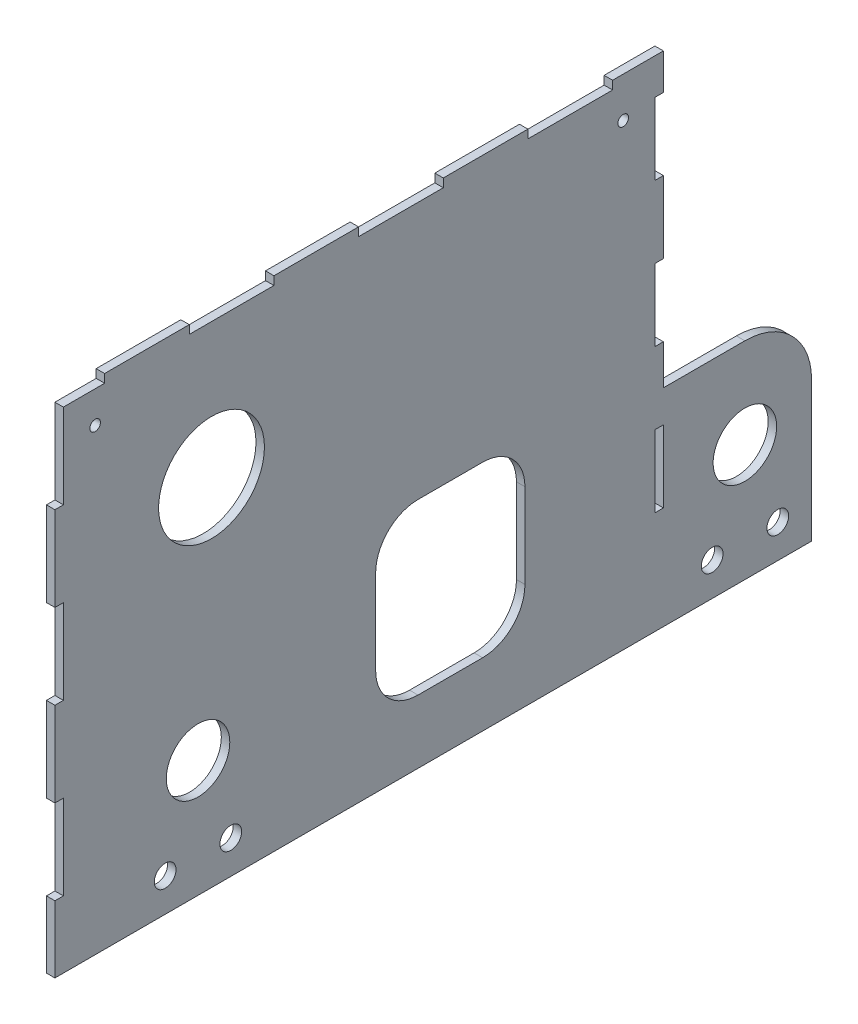
from build123d import *

# Parameters (mm, degrees)
SKETCH1_W                   = 224.46234
SKETCH1_H                   = 149.606
BOSS_EXTRUDE1_DEPTH         = 2.54
SKETCH2_W                   = 44.45
SKETCH2_H                   = 87.5411
CUT_EXTRUDE1_DEPTH          = 135.899132423
FILLET1_R                   = 20.0025
F_1_4_CLEARANCE_HOLE1_D     = 6.5278
F_1_4_CLEARANCE_HOLE1_DEPTH = 9.398
F_1_4_CLEARANCE_HOLE1_TIP   = 1.961148974
SKETCH6_W                   = 25.4
SKETCH6_H                   = 2.54
CUT_EXTRUDE2_DEPTH          = 135.899132423
LPATTERN1_COUNT             = 4
LPATTERN1_PITCH             = 50.8
SKETCH7_W                   = 2.54
SKETCH7_H                   = 21.59
CUT_EXTRUDE3_DEPTH          = 135.899132423
LPATTERN2_COUNT             = 3
LPATTERN2_PITCH             = 43.18
SKETCH8_R                   = 9.525
CUT_EXTRUDE4_DEPTH          = 135.899132423
SKETCH9_R                   = 15.875
SKETCH9_W                   = 44.7802
SKETCH9_H                   = 50.8
CUT_EXTRUDE5_DEPTH          = 135.899132423
FILLET2_R                   = 12.7
M3_CLEARANCE_HOLE1_D        = 3.2
M3_CLEARANCE_HOLE1_DEPTH    = 9.398
M3_CLEARANCE_HOLE1_TIP      = 0.96137699
SKETCH16_W                  = 2.54
SKETCH16_H                  = 25.4
BOSS_EXTRUDE2_DEPTH         = 2.54
LPATTERN3_COUNT             = 3
LPATTERN3_PITCH             = 50.8
SKETCH18_W                  = 2.54
SKETCH18_H                  = 5.334
CUT_EXTRUDE7_DEPTH          = 141.002899371


with BuildPart() as part:
    # Sketch1 → Boss-Extrude1 (new body)
    with BuildSketch(Plane(origin=(0, 0, 0), x_dir=(0, 0, -1), z_dir=(1, 0, 0))):
        Rectangle(SKETCH1_W, SKETCH1_H)
    extrude(amount=BOSS_EXTRUDE1_DEPTH)

    # Sketch2 → Cut-Extrude1 (cut, through all)
    with BuildSketch(Plane(origin=(2.54, 0, 0), x_dir=(0, 0, -1), z_dir=(1, 0, 0))):
        with Locations((90.00617, 31.03245)):
            Rectangle(SKETCH2_W, SKETCH2_H)
    extrude(amount=-CUT_EXTRUDE1_DEPTH, mode=Mode.SUBTRACT)

    # Fillet1
    fillet1_edges = [part.edges().sort_by_distance(p)[0] for p in [
        (1.27, -12.7381, -112.23117),
    ]]
    fillet(fillet1_edges, radius=FILLET1_R)

    # 1/4 Clearance Hole1
    with Locations(Plane(origin=(2.54, 0, 0), x_dir=(0, 0, -1), z_dir=(1, 0, 0))):
        with Locations((-81.69783, -64.77), (-62.01283, -64.77), (102.09657, -64.77), (82.41157, -64.77)):
            Hole(F_1_4_CLEARANCE_HOLE1_D / 2, depth=F_1_4_CLEARANCE_HOLE1_DEPTH)
            with Locations((0, 0, -(F_1_4_CLEARANCE_HOLE1_DEPTH + F_1_4_CLEARANCE_HOLE1_TIP / 2))):  # 118° drill point
                Cone(0, F_1_4_CLEARANCE_HOLE1_D / 2, F_1_4_CLEARANCE_HOLE1_TIP, mode=Mode.SUBTRACT)

    # Sketch6 → Cut-Extrude2 (cut, through all)
    with BuildSketch(Plane(origin=(2.54, 0, 0), x_dir=(0, 0, -1), z_dir=(1, 0, 0))):
        with Locations((39.84117, 73.533)):
            Rectangle(SKETCH6_W, SKETCH6_H)
    cut_extrude2 = extrude(amount=-CUT_EXTRUDE2_DEPTH, mode=Mode.SUBTRACT)

    # LPattern1: Cut-Extrude2 ×4
    with Locations(*[(0, 0, i * LPATTERN1_PITCH) for i in range(1, LPATTERN1_COUNT)]):
        add(cut_extrude2, mode=Mode.SUBTRACT)

    # Sketch7 → Cut-Extrude3 (cut, through all)
    with BuildSketch(Plane(origin=(2.54, 0, 0), x_dir=(0, 0, -1), z_dir=(1, 0, 0))):
        with Locations((66.51117, 53.213)):
            Rectangle(SKETCH7_W, SKETCH7_H)
    cut_extrude3 = extrude(amount=-CUT_EXTRUDE3_DEPTH, mode=Mode.SUBTRACT)

    # LPattern2: Cut-Extrude3 ×3
    with Locations(*[(0, -i * LPATTERN2_PITCH, 0) for i in range(1, LPATTERN2_COUNT)]):
        add(cut_extrude3, mode=Mode.SUBTRACT)

    # Sketch8 → Cut-Extrude4 (cut, through all)
    with BuildSketch(Plane(origin=(2.54, 0, 0), x_dir=(0, 0, -1), z_dir=(1, 0, 0))):
        with Locations((92.22867, -39.7370046)):
            Circle(SKETCH8_R)
        with Locations((-71.82993, -39.7370046)):
            Circle(SKETCH8_R)
    extrude(amount=-CUT_EXTRUDE4_DEPTH, mode=Mode.SUBTRACT)

    # Sketch9 → Cut-Extrude5 (cut, through all)
    with BuildSketch(Plane(origin=(2.54, 0, 0), x_dir=(0, 0, -1), z_dir=(1, 0, 0))):
        with Locations((-67.78625, 31.7373)):
            Circle(SKETCH9_R)
        with Locations((3.84937, -30.353)):
            Rectangle(SKETCH9_W, SKETCH9_H)
    extrude(amount=-CUT_EXTRUDE5_DEPTH, mode=Mode.SUBTRACT)

    # Fillet2
    fillet2_edges = [part.edges().sort_by_distance(p)[0] for p in [
        (1.27, -55.753, 18.54073),
        (1.27, -4.953, 18.54073),
        (1.27, -4.953, -26.23947),
        (1.27, -55.753, -26.23947),
    ]]
    fillet(fillet2_edges, radius=FILLET2_R)

    # M3 Clearance Hole1
    with Locations(Plane(origin=(2.54, 0, 0), x_dir=(0, 0, -1), z_dir=(1, 0, 0))):
        with Locations((-102.70617, 62.738), (55.71617, 62.738)):
            Hole(M3_CLEARANCE_HOLE1_D / 2, depth=M3_CLEARANCE_HOLE1_DEPTH)
            with Locations((0, 0, -(M3_CLEARANCE_HOLE1_DEPTH + M3_CLEARANCE_HOLE1_TIP / 2))):  # 118° drill point
                Cone(0, M3_CLEARANCE_HOLE1_D / 2, M3_CLEARANCE_HOLE1_TIP, mode=Mode.SUBTRACT)

    # Sketch16 → Boss-Extrude2 (add)
    with BuildSketch(Plane(origin=(2.54, 0, 0), x_dir=(0, 0, -1), z_dir=(1, 0, 0))):
        with Locations((-113.50117, 34.163)):
            Rectangle(SKETCH16_W, SKETCH16_H)
    boss_extrude2 = extrude(amount=-BOSS_EXTRUDE2_DEPTH)

    # LPattern3: Boss-Extrude2 ×3
    with Locations(*[(0, -i * LPATTERN3_PITCH, 0) for i in range(1, LPATTERN3_COUNT)]):
        add(boss_extrude2)

    # Sketch18 → Cut-Extrude7 (cut, through all)
    with BuildSketch(Plane(origin=(2.54, 0, 0), x_dir=(0, 0, -1), z_dir=(1, 0, 0))):
        with Locations((-113.50117, -77.47)):
            Rectangle(SKETCH18_W, SKETCH18_H)
    extrude(amount=-CUT_EXTRUDE7_DEPTH, mode=Mode.SUBTRACT)


solid = part.part
